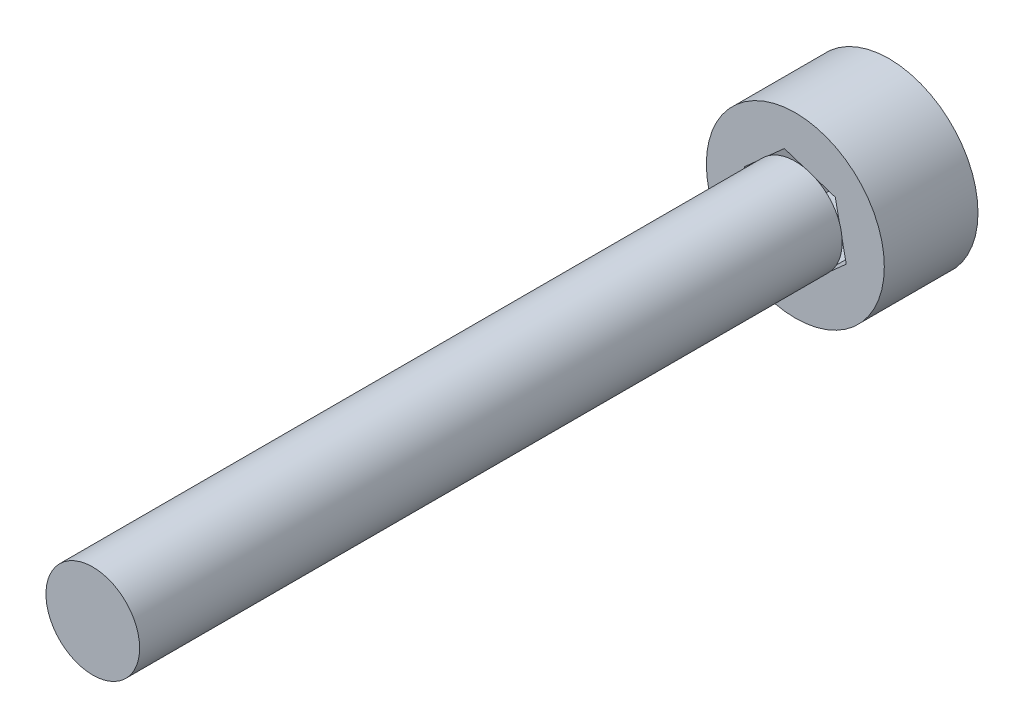
from build123d import *

# Parameters (mm, degrees)
SKETCH_1_R          = 1.9
EXTRUDE_1_DEPTH     = 2
SKETCH_2_R          = 1
EXTRUDE_2_DEPTH     = 15
CUT_EXTRUDE_1_DEPTH = 2


with BuildPart() as part:
    # ｽｹｯﾁ1 → ﾎﾞｽ - 押し出し1 (new body)
    with BuildSketch(Plane.XY):
        Circle(SKETCH_1_R)
    extrude(amount=EXTRUDE_1_DEPTH)

    # ｽｹｯﾁ2 → ﾎﾞｽ - 押し出し2 (add)
    with BuildSketch(Plane.XY.offset(2)):
        Circle(SKETCH_2_R)
    extrude(amount=EXTRUDE_2_DEPTH)

    # ｽｹｯﾁ3 → ｶｯﾄ - 押し出し1 (cut)
    with BuildSketch(Plane(origin=(0, 0, 0), x_dir=(-1, 0, 0), z_dir=(0, 0, -1))):
        Polygon((0.852242502, -0.763657679), (1.087468201, 0.356234818), (0.235225699, 1.119892496), (-0.852242502, 0.763657679), (-1.087468201, -0.356234818), (-0.235225699, -1.119892496), align=None)
    extrude(amount=-CUT_EXTRUDE_1_DEPTH, mode=Mode.SUBTRACT)


solid = part.part
